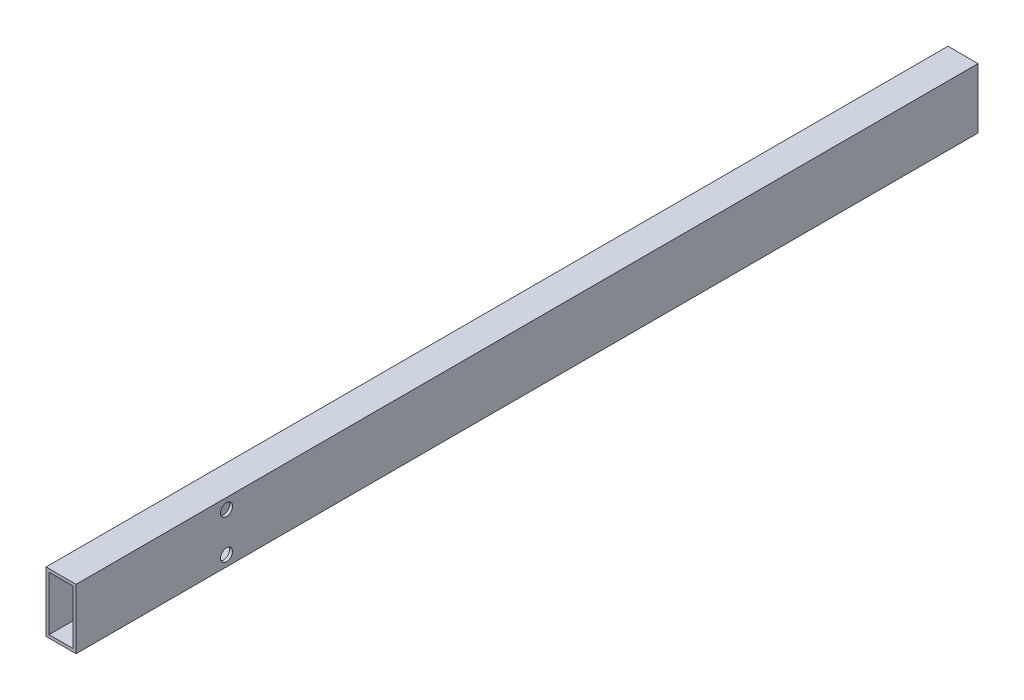
from build123d import *

# Parameters (mm, degrees)
IZIM1_W                     = 10
IZIM1_H                     = 20
Y_KSEKLIK_EKSTR_ZYON1_DEPTH = 150
BO_ALTMA1_T                 = -1
IZIM4_R                     = 2
KES_EKSTR_ZYON3_DEPTH       = 18


with BuildPart() as part:
    # Çizim1 → Yükseklik-Ekstrüzyon1 (new, symmetric)
    with BuildSketch(Plane.XY):
        Rectangle(IZIM1_W, IZIM1_H)
    extrude(amount=Y_KSEKLIK_EKSTR_ZYON1_DEPTH, both=True)

    # İç Boşaltma1
    bo_altma1_openings = [part.faces().sort_by_distance(p)[0] for p in [
        (0, 0, 150),
    ]]
    offset(amount=BO_ALTMA1_T, openings=bo_altma1_openings, kind=Kind.INTERSECTION)

    # Çizim4 → Kes-Ekstrüzyon3 (cut)
    with BuildSketch(Plane(origin=(5, 0, 0), x_dir=(0, 0, -1), z_dir=(1, 0, 0))):
        with Locations(Location((-99.95519869, 6.5, 0), (0, 0, 90))):
            Circle(IZIM4_R)
        with Locations(Location((-99.95519869, -6.5, 0), (0, 0, 90))):
            Circle(IZIM4_R)
    extrude(amount=-KES_EKSTR_ZYON3_DEPTH, mode=Mode.SUBTRACT)


solid = part.part
